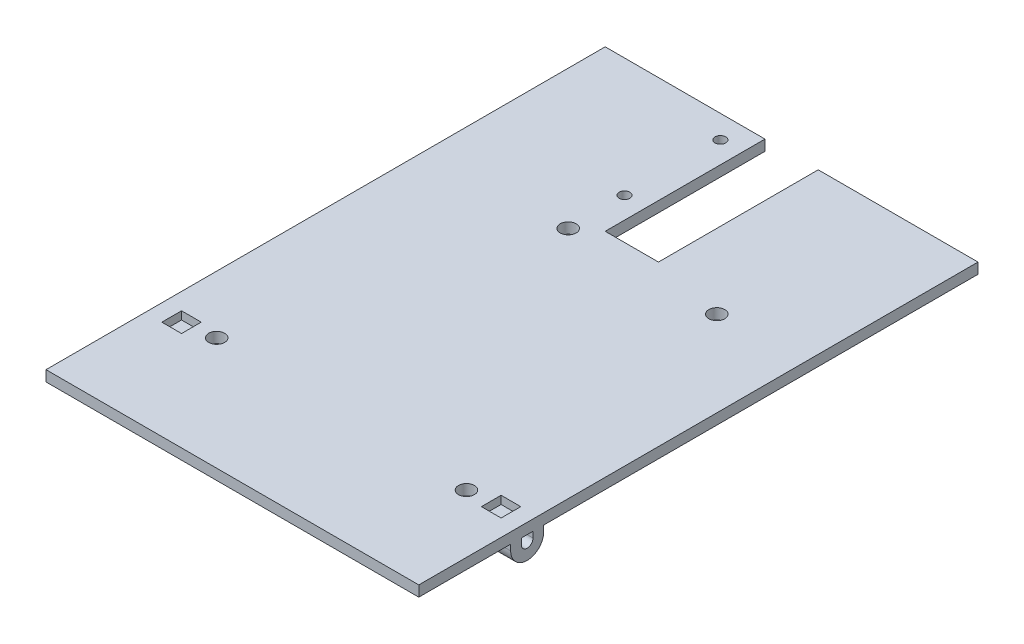
from build123d import *

# Parameters (mm, degrees)
SKETCH1_R               = 1
SKETCH1_W               = 3.1
SKETCH1_H               = 3.1
BOSS_EXTRUDE1_DEPTH     = 2
BOSS_EXTRUDE2_DEPTH     = 3
SKETCH4_W               = 3.1
SKETCH4_H               = 3.1
BOSS_EXTRUDE3_DEPTH     = 0.5
SKETCH5_W               = 3.7
SKETCH5_H               = 3.7
CUT_EXTRUDE1_DEPTH      = 1.5
CUT_EXTRUDE2_DEPTH      = 64.401025228
CUT_EXTRUDE2_DEPTH_BACK = 64.401025228
SKETCH6_R               = 1.5


with BuildPart() as part:
    # Sketch1 → Boss-Extrude1 (new body)
    with BuildSketch(Plane(origin=(0, 0, 0), x_dir=(1, 0, 0), z_dir=(0, 1, 0))):
        Polygon((-5, 52.5), (-5, 22.5), (5, 22.5), (5, 52.5), (35, 52.5), (35, -52.5), (-35, -52.5), (-35, 52.5), align=None)
        with Locations(Location((-9.049911388, 48.178259549, 0), (0, 0, 270))):
            Circle(SKETCH1_R, mode=Mode.SUBTRACT)
        with Locations(Location((-9.049911388, 30.178259549, 0), (0, 0, 270))):
            Circle(SKETCH1_R, mode=Mode.SUBTRACT)
        with Locations((-30, -32.05)):
            Rectangle(SKETCH1_W, SKETCH1_H, mode=Mode.SUBTRACT)
        with Locations((30, -32.05)):
            Rectangle(SKETCH1_W, SKETCH1_H, mode=Mode.SUBTRACT)
    extrude(amount=BOSS_EXTRUDE1_DEPTH)

    # Sketch3 → Boss-Extrude2 (add)
    with BuildSketch(Plane(origin=(35, 0, 0), x_dir=(0, 0, -1), z_dir=(1, 0, 0))):
        with BuildLine():
            Line((-33.25, 0), (-35.25, 0))
            Line((-35.25, 0), (-35.25, -1.1))
            ThreePointArc((-35.25, -1.1), (-32.15, -4.2), (-29.05, -1.1))
            Line((-29.05, -1.1), (-29.05, 0))
            Line((-29.05, 0), (-31.05, 0))
            Line((-31.05, 0), (-31.05, -1.1))
            ThreePointArc((-31.05, -1.1), (-32.15, -2.2), (-33.25, -1.1))
            Line((-33.25, -1.1), (-33.25, 0))
        make_face()
    boss_extrude2 = extrude(amount=-BOSS_EXTRUDE2_DEPTH)

    # Mirror1: Boss-Extrude2 across plane
    add(boss_extrude2.mirror(Plane(origin=(0, 0, 0), x_dir=(0, 0, 1), z_dir=(1, 0, 0))))

    # Sketch4 → Boss-Extrude3 (add)
    with BuildSketch(Plane.XZ):
        with Locations((-30, 32.05)):
            Rectangle(SKETCH4_W, SKETCH4_H)
        with Locations((30, 32.05)):
            Rectangle(SKETCH4_W, SKETCH4_H)
    extrude(amount=-BOSS_EXTRUDE3_DEPTH)

    # Sketch5 → Cut-Extrude1 (cut)
    with BuildSketch(Plane(origin=(0, 2, 0), x_dir=(1, 0, 0), z_dir=(0, 1, 0))):
        with Locations((-30, -32.05)):
            Rectangle(SKETCH5_W, SKETCH5_H)
        with Locations((30, -32.05)):
            Rectangle(SKETCH5_W, SKETCH5_H)
    extrude(amount=-CUT_EXTRUDE1_DEPTH, mode=Mode.SUBTRACT)

    # Sketch6 → Cut-Extrude2 (cut, two sides: drawn at the far end of the back side and taken through both)
    with BuildSketch(Plane(origin=(0, 2, 0), x_dir=(1, 0, 0), z_dir=(0, 1, 0)).offset(-CUT_EXTRUDE2_DEPTH_BACK)):
        with Locations(Location((-8.95, 19.5, 0), (0, 0, 270))):
            Circle(SKETCH6_R)
        with Locations(Location((18.95, 19.5, 0), (0, 0, 270))):
            Circle(SKETCH6_R)
        with Locations(Location((24.05, -32.6, 0), (0, 0, 270))):
            Circle(SKETCH6_R)
        with Locations(Location((-24.15, -31.3, 0), (0, 0, 270))):
            Circle(SKETCH6_R)
    extrude(amount=CUT_EXTRUDE2_DEPTH + CUT_EXTRUDE2_DEPTH_BACK, mode=Mode.SUBTRACT)


solid = part.part
